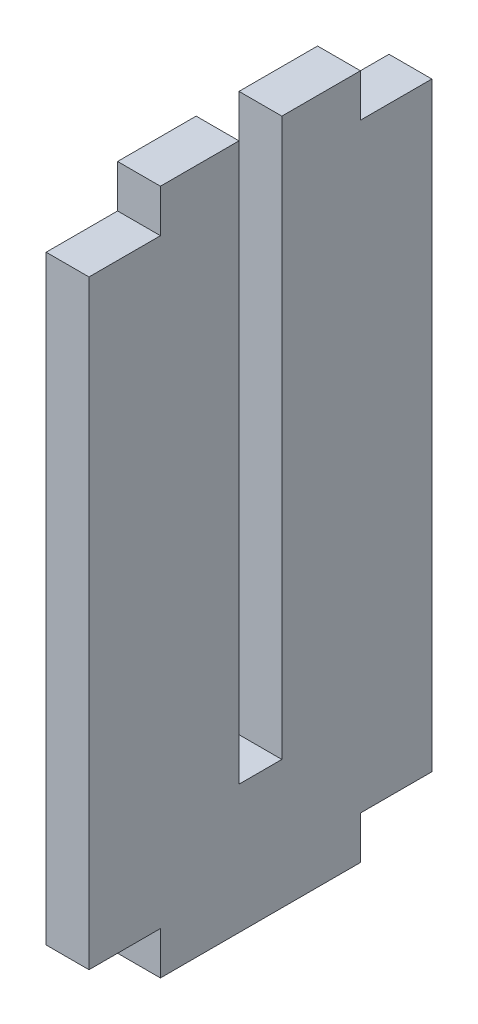
from build123d import *

# Parameters (mm, degrees)
SKETCH1_W           = 50.8
SKETCH1_H           = 101.6
BOSS_EXTRUDE1_DEPTH = 6.35
SKETCH2_W           = 10.583333333
SKETCH2_H           = 6.35
SKETCH2_W_2         = 6.35
SKETCH2_H_2         = 82.55
CUT_EXTRUDE1_DEPTH  = 6.35


with BuildPart() as part:
    # Sketch1 → Boss-Extrude1 (new body)
    with BuildSketch(Plane(origin=(0, 0, 0), x_dir=(0, 0, -1), z_dir=(1, 0, 0))):
        with Locations((25.4, 50.8)):
            Rectangle(SKETCH1_W, SKETCH1_H)
    extrude(amount=BOSS_EXTRUDE1_DEPTH)

    # Sketch2 → Cut-Extrude1 (cut)
    with BuildSketch(Plane(origin=(6.35, 0, 0), x_dir=(0, 0, -1), z_dir=(1, 0, 0))):
        with Locations((45.508333334, 98.425)):
            Rectangle(SKETCH2_W, SKETCH2_H)
        with Locations((25.4, 60.325)):
            Rectangle(SKETCH2_W_2, SKETCH2_H_2)
        with Locations((5.291666667, 98.425)):
            Rectangle(SKETCH2_W, SKETCH2_H)
        with Locations((45.508333334, 3.175)):
            Rectangle(SKETCH2_W, SKETCH2_H)
        with Locations((5.291666667, 3.175)):
            Rectangle(SKETCH2_W, SKETCH2_H)
    extrude(amount=-CUT_EXTRUDE1_DEPTH, mode=Mode.SUBTRACT)


solid = part.part
